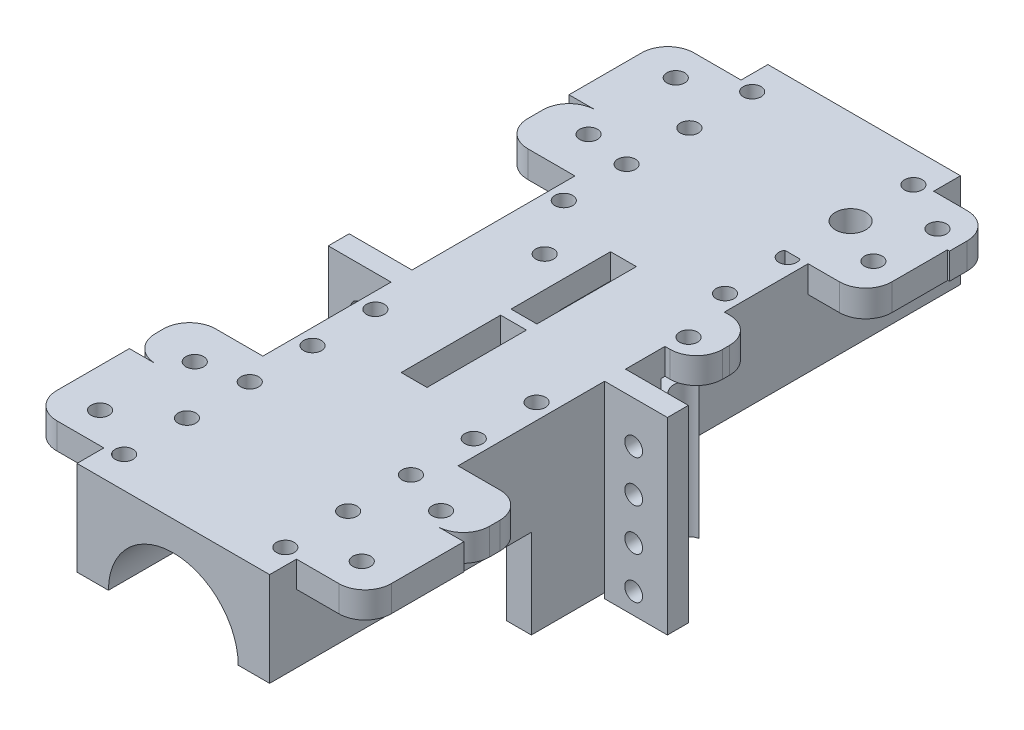
from build123d import *

# Parameters (mm, degrees)
BOSS_EXTRU_1_DEPTH       = 132
ESQUISSE3_W              = 4.94012132
ESQUISSE3_H              = 40
ENL_V_MAT_EXTRU_2_DEPTH  = 9
ESQUISSE4_R              = 1.7
ENL_V_MAT_EXTRU_3_DEPTH  = 18
BOSS_EXTRU_2_REACH       = 140.211
ESQUISSE7_W              = 2
ESQUISSE7_H              = 18
ENL_V_MAT_EXTRU_5_DEPTH  = 15
ENL_V_START              = 15
ENL_V_MAT_EXTRU_6_DEPTH  = 15
ESQUISSE10_W             = 5.625
ESQUISSE10_H             = 32
BOSS_EXTRU_3_DEPTH       = 17
ESQUISSE21_W             = 12.870650759
ESQUISSE21_H             = 5.1
ESQUISSE21_W_2           = 11.50577473
BOSS_EXTRU_7_DEPTH       = 14
ESQUISSE12_W             = 12
ESQUISSE12_H             = 8
BOSS_EXTRU_4_DEPTH       = 13
ESQUISSE14_W             = 11.349962924
ESQUISSE14_H             = 7.588006138
BOSS_EXTRU_5_DEPTH       = 6
ESQUISSE16_W             = 13.258712606
ESQUISSE16_H             = 4.272246905
ENL_V_MAT_EXTRU_7_DEPTH  = 11
BOSS_EXTRU_6_DEPTH       = 11
BOSS_EXTRU_6_DEPTH_BACK  = 11
ESQUISSE17_W             = 15.613345165
ESQUISSE17_H             = 5.100882875
ESQUISSE11_R             = 1.7
ESQUISSE11_R_2           = 1.3
ESQUISSE11_R_3           = 2.916438904
ENL_V_MAT_EXTRU_8_DEPTH  = 8
CONG_1_R                 = 5
ESQUISSE18_W             = 9.677736186
ESQUISSE18_H             = 8.253244783
ENL_V_MAT_EXTRU_9_DEPTH  = 10
ESQUISSE19_W             = 139.450699615
ESQUISSE19_H             = 7.59460478
ENL_V_MAT_EXTRU_10_DEPTH = 24
ESQUISSE20_W             = 27.3
ESQUISSE20_H             = 40.032665724
ENL_V_MAT_EXTRU_11_DEPTH = 22
ESQUISSE22_R             = 2.780350547
ENL_V_MAT_EXTRU_12_DEPTH = 33
ENL_V_MAT_EXTRU_13_DEPTH = 23
ESQUISSE29_W             = 4
ESQUISSE29_H             = 36
BOSS_EXTRU_8_DEPTH       = 12
ESQUISSE30_W             = 4
ESQUISSE30_H             = 36
BOSS_EXTRU_9_DEPTH       = 12
ESQUISSE31_R             = 1.7
ENL_V_MAT_EXTRU_18_DEPTH = 12
ESQUISSE32_R             = 1.7
ENL_V_MAT_EXTRU_19_DEPTH = 12
ESQUISSE34_W             = 14
ESQUISSE34_H             = 18.870064929
ESQUISSE34_H_2           = 18.872361051
ESQUISSE34_W_2           = 13.107419587
ESQUISSE34_W_3           = 11.413970755
ESQUISSE34_H_3           = 8.373824251
BOSS_EXTRU_10_DEPTH      = 5
ESQUISSE33_R             = 1.7
ENL_V_MAT_EXTRU_20_DEPTH = 15
CONG_3_R                 = 5


with BuildPart() as part:
    # Esquisse1 → Boss.-Extru.1 (new body)
    with BuildSketch(Plane.XY):
        with BuildLine():
            Line((-12.4, 0), (-18.4, 0))
            Line((-18.4, 0), (-18.4, 18))
            Line((-18.4, 18), (18.4, 18))
            Line((18.4, 18), (18.4, 0))
            Line((18.4, 0), (12.4, 0))
            ThreePointArc((12.4, 0), (0, 12.4), (-12.4, 0))
        make_face()
    extrude(amount=BOSS_EXTRU_1_DEPTH)

    # Esquisse3 → Enlèv. mat.-Extru.2 (cut)
    with BuildSketch(Plane.XZ.offset(-18)):
        with Locations((0, 66)):
            Rectangle(ESQUISSE3_W, ESQUISSE3_H)
    extrude(amount=ENL_V_MAT_EXTRU_2_DEPTH, mode=Mode.SUBTRACT)

    # Esquisse4 → Enlèv. mat.-Extru.3 (cut)
    with BuildSketch(Plane(origin=(0, 18, 0), x_dir=(1, 0, 0), z_dir=(0, 1, 0))):
        with Locations((15.4, -6)):
            Circle(ESQUISSE4_R)
        with Locations((15.4, -18)):
            Circle(ESQUISSE4_R)
        with Locations((-15.4, -6)):
            Circle(ESQUISSE4_R)
        with Locations((-15.4, -18)):
            Circle(ESQUISSE4_R)
        with Locations((15.4, -30)):
            Circle(ESQUISSE4_R)
        with Locations((-15.4, -30)):
            Circle(ESQUISSE4_R)
        with Locations((15.4, -42)):
            Circle(ESQUISSE4_R)
        with Locations((-15.4, -42)):
            Circle(ESQUISSE4_R)
        with Locations((-15.4, -126)):
            Circle(ESQUISSE4_R)
        with Locations((-15.4, -114)):
            Circle(ESQUISSE4_R)
        with Locations((-15.4, -102)):
            Circle(ESQUISSE4_R)
        with Locations((-15.4, -90)):
            Circle(ESQUISSE4_R)
        with Locations((-15.4, -78)):
            Circle(ESQUISSE4_R)
        with Locations((15.4, -78)):
            Circle(ESQUISSE4_R)
        with Locations((15.4, -90)):
            Circle(ESQUISSE4_R)
        with Locations((15.4, -102)):
            Circle(ESQUISSE4_R)
        with Locations((15.4, -114)):
            Circle(ESQUISSE4_R)
        with Locations((15.4, -126)):
            Circle(ESQUISSE4_R)
    extrude(amount=-ENL_V_MAT_EXTRU_3_DEPTH, mode=Mode.SUBTRACT)

    # Esquisse7 → Boss.-Extru.2 (add, up to next)
    with BuildSketch(Plane.ZY.offset(18.4), mode=Mode.PRIVATE) as boss_extru_2_sk1:
        with Locations((66, 9)):
            Rectangle(ESQUISSE7_W, ESQUISSE7_H)
    boss_extru_2_tool1 = extrude(boss_extru_2_sk1.sketch, amount=-BOSS_EXTRU_2_REACH, mode=Mode.PRIVATE) - part.part
    add(boss_extru_2_tool1.solids().sort_by_distance((-18.4, 9, 66))[0])

    # Esquisse8 → Enlèv. mat.-Extru.5 (cut)
    with BuildSketch(Plane(origin=(0, 0, 65), x_dir=(-1, 0, 0), z_dir=(0, 0, -1))):
        with BuildLine():
            Line((12.775, 0), (-12.775, 0))
            ThreePointArc((-12.775, 0), (0, 12.775), (12.775, 0))
        make_face()
    extrude(amount=ENL_V_MAT_EXTRU_5_DEPTH, mode=Mode.SUBTRACT)

    # Esquisse9 → Enlèv. mat.-Extru.6 (cut)
    with BuildSketch(Plane.XY.offset(67).offset(ENL_V_START)):
        with BuildLine():
            Line((12.775, 0), (-12.775, 0))
            ThreePointArc((-12.775, 0), (0, 12.775), (12.775, 0))
        make_face()
    extrude(amount=-ENL_V_MAT_EXTRU_6_DEPTH, mode=Mode.SUBTRACT)

    # Esquisse10 → Boss.-Extru.3 (add)
    with BuildSketch(Plane.XZ):
        with Locations((15.5875, 66)):
            Rectangle(ESQUISSE10_W, ESQUISSE10_H)
        with Locations((-15.5875, 66)):
            Rectangle(ESQUISSE10_W, ESQUISSE10_H)
    extrude(amount=BOSS_EXTRU_3_DEPTH)

    # Esquisse21 → Boss.-Extru.7 (add)
    with BuildSketch(Plane.ZY.offset(18.4)):
        with Locations((30.43532538, 15.45)):
            Rectangle(ESQUISSE21_W, ESQUISSE21_H)
        with Locations((102.247112635, 15.45)):
            Rectangle(ESQUISSE21_W_2, ESQUISSE21_H)
    extrude(amount=BOSS_EXTRU_7_DEPTH)

    # Esquisse12 → Boss.-Extru.4 (add)
    with BuildSketch(Plane(origin=(18.4, 0, 0), x_dir=(0, 0, -1), z_dir=(1, 0, 0))):
        with Locations((-102, 14)):
            Rectangle(ESQUISSE12_W, ESQUISSE12_H)
    extrude(amount=BOSS_EXTRU_4_DEPTH)

    # Esquisse14 → Boss.-Extru.5 (add)
    with BuildSketch(Plane(origin=(18.4, 0, 0), x_dir=(0, 0, -1), z_dir=(1, 0, 0))):
        with Locations((-50.7944077, 14.205996931)):
            Rectangle(ESQUISSE14_W, ESQUISSE14_H)
    extrude(amount=BOSS_EXTRU_5_DEPTH)

    # Esquisse16 → Enlèv. mat.-Extru.7 (cut)
    with BuildSketch(Plane(origin=(24.4, 0, 0), x_dir=(0, 0, -1), z_dir=(1, 0, 0))):
        with Locations((-50.566594151, 10.91391733)):
            Rectangle(ESQUISSE16_W, ESQUISSE16_H)
    extrude(amount=-ENL_V_MAT_EXTRU_7_DEPTH, mode=Mode.SUBTRACT)

    # Esquisse17 → Boss.-Extru.6 (add, two sides: drawn at the far end of the back side and taken through both)
    with BuildSketch(Plane(origin=(18.4, 0, 0), x_dir=(0, 0, -1), z_dir=(1, 0, 0)).offset(-BOSS_EXTRU_6_DEPTH_BACK)):
        with Locations((-21.308135783, 15.449558563)):
            Rectangle(ESQUISSE17_W, ESQUISSE17_H)
    extrude(amount=BOSS_EXTRU_6_DEPTH + BOSS_EXTRU_6_DEPTH_BACK)

    # Esquisse11 → Enlèv. mat.-Extru.8 (cut)
    with BuildSketch(Plane(origin=(0, 18, 0), x_dir=(1, 0, 0), z_dir=(0, 1, 0))):
        with Locations((24.22, -105.065455989)):
            Circle(ESQUISSE11_R)
        with Locations((19.13, -52.682438015)):
            Circle(ESQUISSE11_R)
        with Locations((24.22, -22.462438015)):
            Circle(ESQUISSE11_R)
        with Locations((-8.37, -52.682438015)):
            Circle(ESQUISSE11_R)
        with Locations((15.4, -6)):
            Circle(ESQUISSE11_R_2)
        with Locations((15.4, -18)):
            Circle(ESQUISSE11_R_3)
        with Locations((-23.98, -103.922438015)):
            Circle(ESQUISSE11_R)
        with Locations((-23.98, -28.682438015)):
            Circle(ESQUISSE11_R)
    extrude(amount=-ENL_V_MAT_EXTRU_8_DEPTH, mode=Mode.SUBTRACT)

    # Congé1
    cong_1_edges = [part.edges().sort_by_distance(p)[0] for p in [
        (24.4, 15.525020391, 45.119426238),
        (24.4, 15.525020391, 56.469389162),
        (31.4, 14, 96),
        (31.4, 14, 108),
        (29.4, 15.449558563, 29.114808365),
        (-32.4, 15.45, 108),
        (-32.4, 15.45, 96.49422527),
        (-32.4, 15.45, 36.870650759),
        (-32.4, 15.45, 24),
    ]]
    fillet(cong_1_edges, radius=CONG_1_R)

    # Esquisse18 → Enlèv. mat.-Extru.9 (cut)
    with BuildSketch(Plane(origin=(-2.47006066, 0, 0), x_dir=(0, 0, -1), z_dir=(1, 0, 0))):
        with Locations((-50.900131157, 9.01339788)):
            Rectangle(ESQUISSE18_W, ESQUISSE18_H)
    extrude(amount=-ENL_V_MAT_EXTRU_9_DEPTH, mode=Mode.SUBTRACT)

    # Esquisse19 → Enlèv. mat.-Extru.10 (cut)
    with BuildSketch(Plane(origin=(18.4, 0, 0), x_dir=(0, 0, -1), z_dir=(1, 0, 0))):
        with Locations((-62.274650192, 9.101814735)):
            Rectangle(ESQUISSE19_W, ESQUISSE19_H)
    extrude(amount=ENL_V_MAT_EXTRU_10_DEPTH, mode=Mode.SUBTRACT)

    # Esquisse20 → Enlèv. mat.-Extru.11 (cut)
    with BuildSketch(Plane.XZ):
        with Locations((0, 66)):
            Rectangle(ESQUISSE20_W, ESQUISSE20_H)
    extrude(amount=ENL_V_MAT_EXTRU_11_DEPTH, mode=Mode.SUBTRACT)

    # Esquisse22 → Enlèv. mat.-Extru.12 (cut)
    with BuildSketch(Plane.XZ.offset(-13.050040782)):
        with Locations((19.13, 52.682438015)):
            Circle(ESQUISSE22_R)
    extrude(amount=ENL_V_MAT_EXTRU_12_DEPTH, mode=Mode.SUBTRACT)

    # Esquisse23 → Enlèv. mat.-Extru.13 (cut)
    with BuildSketch(Plane.XZ.offset(-13.140020271)):
        Polygon((-10.962659815, 54.736061467), (-30.574521602, 60.209177611), (-30.574521602, 54.651975737), (-10.962659815, 50.396101529), align=None)
    extrude(amount=ENL_V_MAT_EXTRU_13_DEPTH, mode=Mode.SUBTRACT)

    # Esquisse29 → Boss.-Extru.8 (add)
    with BuildSketch(Plane(origin=(18.4, 0, 0), x_dir=(0, 0, -1), z_dir=(1, 0, 0))):
        with Locations((-66, 0)):
            Rectangle(ESQUISSE29_W, ESQUISSE29_H)
    extrude(amount=BOSS_EXTRU_8_DEPTH)

    # Esquisse30 → Boss.-Extru.9 (add)
    with BuildSketch(Plane.ZY.offset(18.4)):
        with Locations((70, 0)):
            Rectangle(ESQUISSE30_W, ESQUISSE30_H)
    extrude(amount=BOSS_EXTRU_9_DEPTH)

    # Esquisse31 → Enlèv. mat.-Extru.18 (cut)
    with BuildSketch(Plane.XY.offset(68)):
        with Locations((23.954865258, 10)):
            Circle(ESQUISSE31_R)
        with Locations((23.954865258, 2)):
            Circle(ESQUISSE31_R)
        with Locations((23.954865258, -6)):
            Circle(ESQUISSE31_R)
        with Locations((23.954865258, -14)):
            Circle(ESQUISSE31_R)
    extrude(amount=-ENL_V_MAT_EXTRU_18_DEPTH, mode=Mode.SUBTRACT)

    # Esquisse32 → Enlèv. mat.-Extru.19 (cut)
    with BuildSketch(Plane.XY.offset(72)):
        with Locations((-24.4, 10)):
            Circle(ESQUISSE32_R)
        with Locations((-24.4, 2)):
            Circle(ESQUISSE32_R)
        with Locations((-24.4, -6)):
            Circle(ESQUISSE32_R)
        with Locations((-24.4, -14)):
            Circle(ESQUISSE32_R)
    extrude(amount=-ENL_V_MAT_EXTRU_19_DEPTH, mode=Mode.SUBTRACT)

    # Esquisse34 → Boss.-Extru.10 (add)
    with BuildSketch(Plane(origin=(0, 18, 0), x_dir=(1, 0, 0), z_dir=(0, 1, 0))):
        with Locations((-25.4, -117.435032465)):
            Rectangle(ESQUISSE34_W, ESQUISSE34_H)
        with Locations((-25.4, -14.563819475)):
            Rectangle(ESQUISSE34_W, ESQUISSE34_H_2)
        with Locations((24.953709794, -117.435032465)):
            Rectangle(ESQUISSE34_W_2, ESQUISSE34_H)
        with Locations((24.106985378, -9.314551075)):
            Rectangle(ESQUISSE34_W_3, ESQUISSE34_H_3)
    extrude(amount=-BOSS_EXTRU_10_DEPTH)

    # Esquisse33 → Enlèv. mat.-Extru.20 (cut)
    with BuildSketch(Plane(origin=(0, 18, 0), x_dir=(1, 0, 0), z_dir=(0, 1, 0))):
        with Locations((-25, -121)):
            Circle(ESQUISSE33_R)
        with Locations((25, -121)):
            Circle(ESQUISSE33_R)
        with Locations((25, -11)):
            Circle(ESQUISSE33_R)
        with Locations((-25, -11)):
            Circle(ESQUISSE33_R)
    extrude(amount=-ENL_V_MAT_EXTRU_20_DEPTH, mode=Mode.SUBTRACT)

    # Congé3
    cong_3_edges = [part.edges().sort_by_distance(p)[0] for p in [
        (-32.4, 15.5, 5.127638949),
        (29.813970755, 15.5, 5.127638949),
        (-32.4, 15.5, 126.870064929),
        (31.507419587, 15.5, 126.870064929),
    ]]
    fillet(cong_3_edges, radius=CONG_3_R)


solid = part.part
